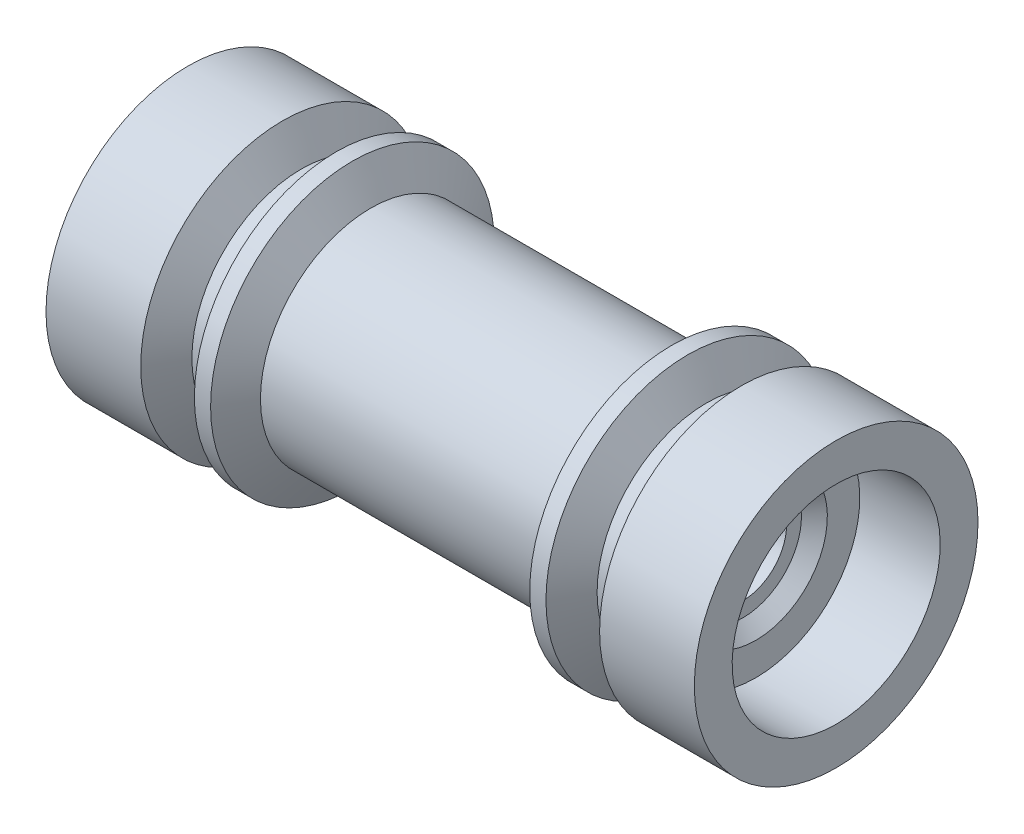
from build123d import *

# Parameters (mm, degrees)
CHAMFER1_SIZE = 0.508


with BuildPart() as part:
    # Sketch2 → Revolve1 (revolve)
    with BuildSketch(Plane.XY, mode=Mode.PRIVATE) as revolve1_sk:
        Polygon((-8.988234842, 5.55625), (-12.7, 5.55625), (-12.7, 4.075), (-9.55, 4.075), (-9.55, 2.805), (-9.042, 2.297), (-9.042, 1.7145), (-2.875, 1.7145), (-2.875, 1.6), (0, 1.6), (0, 4.318), (-5.536861187, 4.318), (-6.251765158, 5.55625), (-6.886765158, 5.55625), (-7.62, 4.28625), (-8.255, 4.28625), align=None)
    revolve(revolve1_sk.sketch.rotate(Axis((-12.7, 0, 0), (1, 0, 0)), 180), axis=Axis((-12.7, 0, 0), (1, 0, 0)))

    # Mirror1: part across plane


with BuildPart() as part_1:
    add(part.part)
    add(part.part.mirror(Plane(origin=(0, 0, 0), x_dir=(0, 0, 1), z_dir=(1, 0, 0))))

    # Chamfer1
    chamfer1_edges = [part_1.edges().sort_by_distance(p)[0] for p in [
        (-12.7, 4.075, 0),
    ]]
    chamfer(chamfer1_edges, length=CHAMFER1_SIZE)


solid = part_1.part
